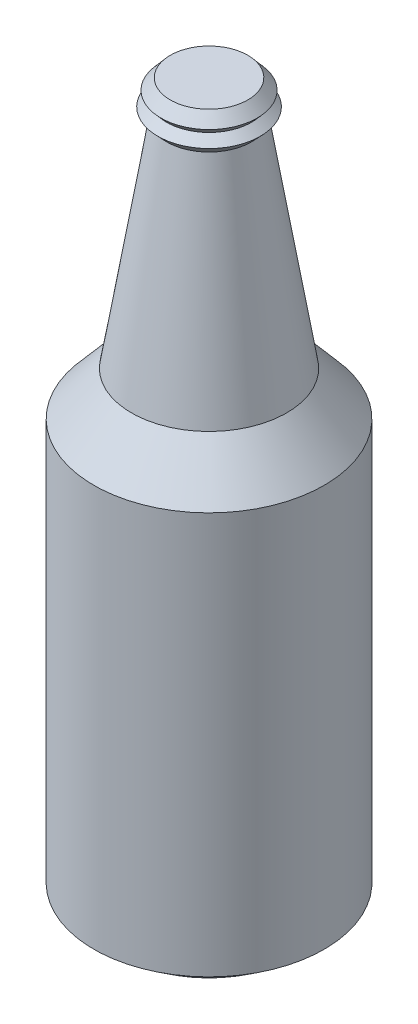
from build123d import *


with BuildPart() as part:
    # Sketch1 → Revolve1 (revolve)
    with BuildSketch(Plane.XY, mode=Mode.PRIVATE) as revolve1_sk:
        Polygon((-2.157924716, 95.627139463), (2.265777561, 95.627139463), (3.339035036, 94.37443965), (2.679211999, 93.617583814), (3.684758174, 92.740953816), (2.679211999, 91.682509349), (6.700975246, 66.896875407), (10.993524502, 61.88663716), (10.993524502, 16.006240694), (7.76796814, 13.615904673), (-2.157924716, 13.615904673), (-2.157924716, 14.635398959), align=None)
    revolve(revolve1_sk.sketch.rotate(Axis((-2.157924716, 14.635398959, 0), (0, 1, 0)), 90), axis=Axis((-2.157924716, 14.635398959, 0), (0, 1, 0)))


solid = part.part
